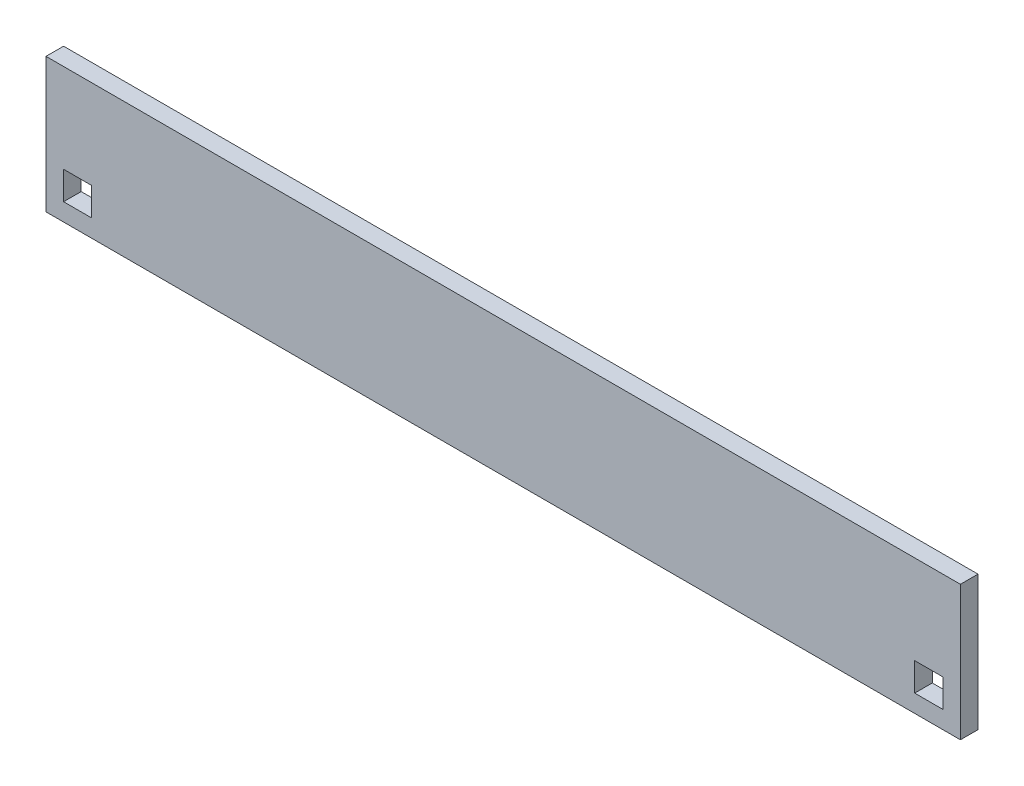
from build123d import *

# Parameters (mm, degrees)
CROQUIS1_W              = 260
CROQUIS1_H              = 38.3035
SALIENTE_EXTRUIR1_DEPTH = 5
CROQUIS2_W              = 8
CROQUIS2_H              = 8
CORTAR_EXTRUIR1_DEPTH   = 10


with BuildPart() as part:
    # Croquis1 → Saliente-Extruir1 (new body)
    with BuildSketch(Plane.XY):
        with Locations((130, 19.15175)):
            Rectangle(CROQUIS1_W, CROQUIS1_H)
    extrude(amount=SALIENTE_EXTRUIR1_DEPTH)

    # Croquis2 → Cortar-Extruir1 (cut)
    with BuildSketch(Plane.XY.offset(5)):
        with Locations((9, 9)):
            Rectangle(CROQUIS2_W, CROQUIS2_H)
        with Locations((251, 9)):
            Rectangle(CROQUIS2_W, CROQUIS2_H)
    extrude(amount=-CORTAR_EXTRUIR1_DEPTH, mode=Mode.SUBTRACT)


solid = part.part
